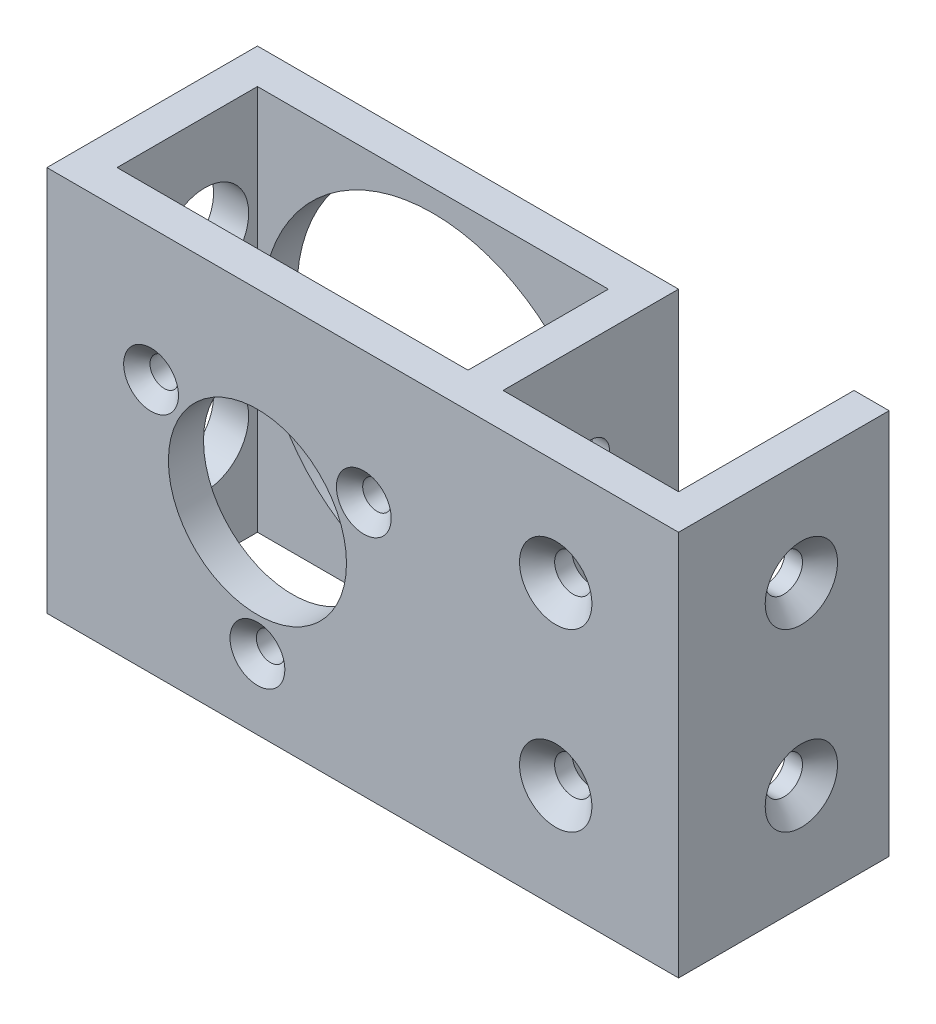
from build123d import *

# Parameters (mm, degrees)
SKETCH1_W           = 40
SKETCH1_H           = 16
BOSS_EXTRUDE1_DEPTH = 44
CUT_EXTRUDE1_REACH  = 86.475
SKETCH3_R           = 19.5
CUT_EXTRUDE2_REACH  = 86.475
SKETCH4_R           = 10.15
SKETCH4_R_2         = 1.625
SKETCH5_R           = 2.125
CUT_EXTRUDE3_DEPTH  = 87.717933555
CUT_EXTRUDE4_REACH  = 86.475
SKETCH6_R           = 2.125
CHAMFER1_SIZE       = 2
CHAMFER2_SIZE       = 1.5
CUT_EXTRUDE5_REACH  = 88.718
SKETCH7_R           = 5


with BuildPart() as part:
    # Sketch1 → Boss-Extrude1 (new body)
    with BuildSketch(Plane(origin=(0, 0, 0), x_dir=(1, 0, 0), z_dir=(0, 1, 0))):
        Polygon((0, 0), (0, 20), (4, 20), (4, -4), (-24, -4), (-68, -4), (-68, 0), (-68, 16), (-68, 20), (-24, 20), (-20, 20), (-20, 0), align=None)
        with Locations((-44, 8)):
            Rectangle(SKETCH1_W, SKETCH1_H, mode=Mode.SUBTRACT)
    extrude(amount=BOSS_EXTRUDE1_DEPTH)

    # Sketch3 → Cut-Extrude1 (cut, up to next)
    with BuildSketch(Plane(origin=(0, 0, -20), x_dir=(-1, 0, 0), z_dir=(0, 0, -1)), mode=Mode.PRIVATE) as cut_extrude1_sk1:
        with Locations((44, 22)):
            Circle(SKETCH3_R)
    cut_extrude1_tool1 = extrude(cut_extrude1_sk1.sketch, amount=-CUT_EXTRUDE1_REACH, mode=Mode.PRIVATE) & part.part
    add(cut_extrude1_tool1.solids().sort_by_distance((-44, 22, -20))[0], mode=Mode.SUBTRACT)

    # Sketch4 → Cut-Extrude2 (cut, up to next)
    with BuildSketch(Plane.XY.offset(4), mode=Mode.PRIVATE) as cut_extrude2_sk1:
        with Locations((-44, 22)):
            Circle(SKETCH4_R)
    cut_extrude2_tool1 = extrude(cut_extrude2_sk1.sketch, amount=-CUT_EXTRUDE2_REACH, mode=Mode.PRIVATE) & part.part
    # Sketch4 → Cut-Extrude2 (cut, up to next)
    with BuildSketch(Plane.XY.offset(4), mode=Mode.PRIVATE) as cut_extrude2_sk2:
        with Locations((-56.124355653, 29)):
            Circle(SKETCH4_R_2)
    cut_extrude2_tool2 = extrude(cut_extrude2_sk2.sketch, amount=-CUT_EXTRUDE2_REACH, mode=Mode.PRIVATE) & part.part
    # Sketch4 → Cut-Extrude2 (cut, up to next)
    with BuildSketch(Plane.XY.offset(4), mode=Mode.PRIVATE) as cut_extrude2_sk3:
        with Locations((-31.875644347, 29)):
            Circle(SKETCH4_R_2)
    cut_extrude2_tool3 = extrude(cut_extrude2_sk3.sketch, amount=-CUT_EXTRUDE2_REACH, mode=Mode.PRIVATE) & part.part
    # Sketch4 → Cut-Extrude2 (cut, up to next)
    with BuildSketch(Plane.XY.offset(4), mode=Mode.PRIVATE) as cut_extrude2_sk4:
        with Locations((-44, 8)):
            Circle(SKETCH4_R_2)
    cut_extrude2_tool4 = extrude(cut_extrude2_sk4.sketch, amount=-CUT_EXTRUDE2_REACH, mode=Mode.PRIVATE) & part.part
    add(cut_extrude2_tool1.solids().sort_by_distance((-44, 22, 4))[0], mode=Mode.SUBTRACT)
    add(cut_extrude2_tool2.solids().sort_by_distance((-56.124356, 29, 4))[0], mode=Mode.SUBTRACT)
    add(cut_extrude2_tool3.solids().sort_by_distance((-31.875644, 29, 4))[0], mode=Mode.SUBTRACT)
    add(cut_extrude2_tool4.solids().sort_by_distance((-44, 8, 4))[0], mode=Mode.SUBTRACT)

    # Sketch5 → Cut-Extrude3 (cut, through all)
    with BuildSketch(Plane(origin=(4, 0, 0), x_dir=(0, 0, -1), z_dir=(1, 0, 0))):
        with Locations(Location((10, 32, 0), (0, 0, 180))):
            Circle(SKETCH5_R)
        with Locations(Location((10, 12, 0), (0, 0, 180))):
            Circle(SKETCH5_R)
    extrude(amount=-CUT_EXTRUDE3_DEPTH, mode=Mode.SUBTRACT)

    # Sketch6 → Cut-Extrude4 (cut, up to next)
    with BuildSketch(Plane.XY.offset(4), mode=Mode.PRIVATE) as cut_extrude4_sk1:
        with Locations((-10, 32)):
            Circle(SKETCH6_R)
    cut_extrude4_tool1 = extrude(cut_extrude4_sk1.sketch, amount=-CUT_EXTRUDE4_REACH, mode=Mode.PRIVATE) & part.part
    # Sketch6 → Cut-Extrude4 (cut, up to next)
    with BuildSketch(Plane.XY.offset(4), mode=Mode.PRIVATE) as cut_extrude4_sk2:
        with Locations((-10, 12)):
            Circle(SKETCH6_R)
    cut_extrude4_tool2 = extrude(cut_extrude4_sk2.sketch, amount=-CUT_EXTRUDE4_REACH, mode=Mode.PRIVATE) & part.part
    add(cut_extrude4_tool1.solids().sort_by_distance((-10, 32, 4))[0], mode=Mode.SUBTRACT)
    add(cut_extrude4_tool2.solids().sort_by_distance((-10, 12, 4))[0], mode=Mode.SUBTRACT)

    # Chamfer1
    chamfer1_edges = [part.edges().sort_by_distance(p)[0] for p in [
        (-12.125, 12, 4),
        (-24, 32, -12.125),
        (4, 32, -12.125),
        (-24, 12, -12.125),
        (4, 12, -12.125),
        (-12.125, 32, 4),
    ]]
    chamfer(chamfer1_edges, length=CHAMFER1_SIZE)

    # Chamfer2
    chamfer2_edges = [part.edges().sort_by_distance(p)[0] for p in [
        (-45.625, 8, 4),
        (-33.500644347, 29, 4),
        (-57.749355653, 29, 4),
    ]]
    chamfer(chamfer2_edges, length=CHAMFER2_SIZE)

    # Sketch7 → Cut-Extrude5 (cut, up to next)
    with BuildSketch(Plane.ZY.offset(68), mode=Mode.PRIVATE) as cut_extrude5_sk1:
        with Locations((-10, 32)):
            Circle(SKETCH7_R)
    cut_extrude5_tool1 = extrude(cut_extrude5_sk1.sketch, amount=-CUT_EXTRUDE5_REACH, mode=Mode.PRIVATE) & part.part
    # Sketch7 → Cut-Extrude5 (cut, up to next)
    with BuildSketch(Plane.ZY.offset(68), mode=Mode.PRIVATE) as cut_extrude5_sk2:
        with Locations((-10, 12)):
            Circle(SKETCH7_R)
    cut_extrude5_tool2 = extrude(cut_extrude5_sk2.sketch, amount=-CUT_EXTRUDE5_REACH, mode=Mode.PRIVATE) & part.part
    add(cut_extrude5_tool1.solids().sort_by_distance((-68, 32, -10))[0], mode=Mode.SUBTRACT)
    add(cut_extrude5_tool2.solids().sort_by_distance((-68, 12, -10))[0], mode=Mode.SUBTRACT)


solid = part.part
